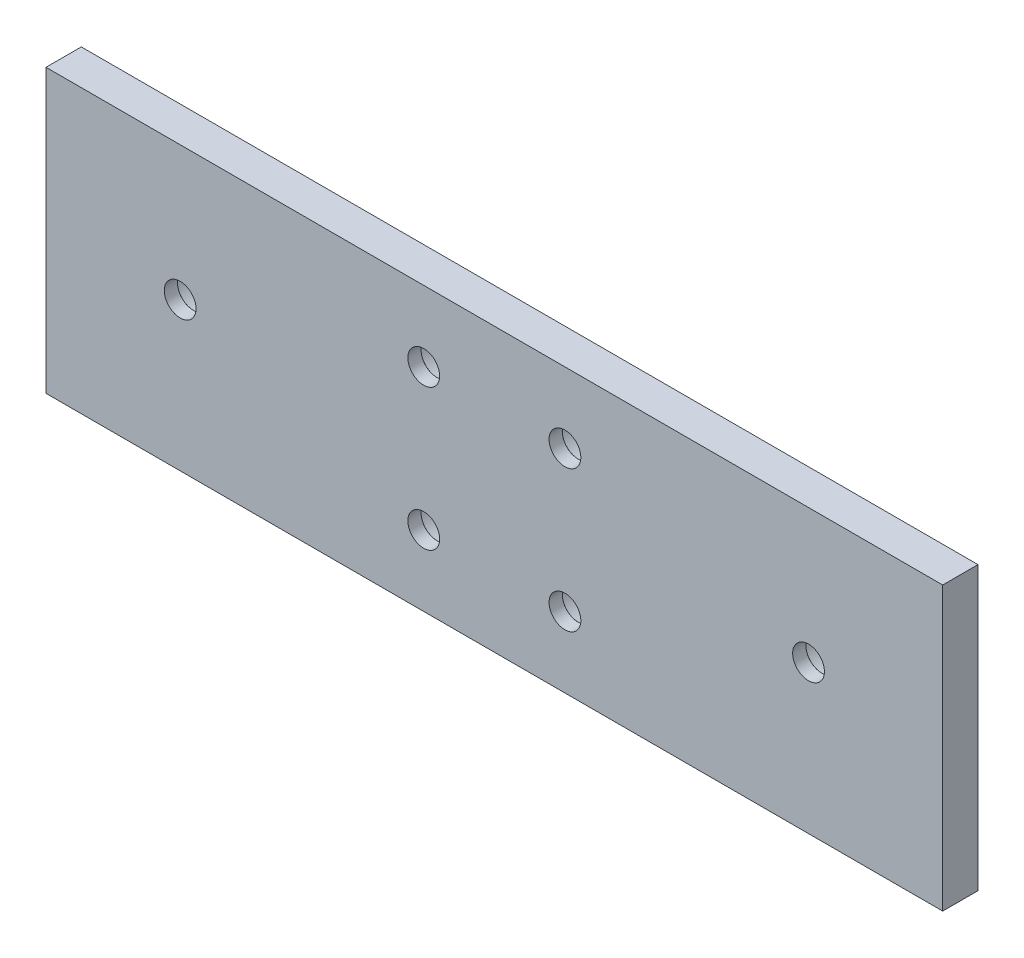
from build123d import *

# Parameters (mm, degrees)
ESQUISSE1_W                                  = 127
ESQUISSE1_H                                  = 40
BOSS_EXTRU_1_DEPTH                           = 5
CHAMBRAGE_POUR_VIS_T_TE_RONDE_BOMB_2_COUNT   = 2
CHAMBRAGE_POUR_VIS_T_TE_RONDE_BOMB_2_PITCH   = 89
D_GAGEMENT_M21_D                             = 2.4
CHAMBRAGE_POUR_VIS_T_TE_RONDE_BOMB_3_A_COUNT = 2
CHAMBRAGE_POUR_VIS_T_TE_RONDE_BOMB_3_A_PITCH = 20
CHAMBRAGE_POUR_VIS_T_TE_RONDE_BOMB_4_COUNT   = 2
CHAMBRAGE_POUR_VIS_T_TE_RONDE_BOMB_4_PITCH   = 20
CHAMBRAGE_POUR_VIS_T_TE_RONDE_BOMB_5_COUNT   = 2
CHAMBRAGE_POUR_VIS_T_TE_RONDE_BOMB_5_PITCH   = 28.284271247


with BuildPart() as part:
    # Esquisse1 → Boss.-Extru.1 (new body)
    with BuildSketch(Plane.XY):
        Rectangle(ESQUISSE1_W, ESQUISSE1_H)
    extrude(amount=BOSS_EXTRU_1_DEPTH)

    # Esquisse2 → Chambrage pour vis _ t_te ronde bomb_e M (revolve, cut)
    with BuildSketch(Plane(origin=(44.5, 1, 0), x_dir=(0, 1, 0), z_dir=(1, 0, 0))):
        Polygon((0, 0), (0, 5), (2.25, 5), (2.25, 3.125), (2.275, 3.1), (4.5, 3.1), (4.5, 0), align=None)
    chambrage_pour_vis_t_te_ronde_bomb_e_m = revolve(axis=Axis((44.5, 1, -6.35), (0, 0, 1)), mode=Mode.SUBTRACT)

    # Chambrage pour vis _ t_te ronde bomb 2: Chambrage pour vis _ t_te ronde bomb_e M ×2
    with Locations(*[(-i * CHAMBRAGE_POUR_VIS_T_TE_RONDE_BOMB_2_PITCH, 0, 0) for i in range(1, CHAMBRAGE_POUR_VIS_T_TE_RONDE_BOMB_2_COUNT)]):
        add(chambrage_pour_vis_t_te_ronde_bomb_e_m, mode=Mode.SUBTRACT)

    # Dégagement M21 (through all)
    with Locations(Plane.XY.offset(5)):
        with Locations((10, -10), (10, 10), (-10, -10), (-10, 10)):
            Hole(D_GAGEMENT_M21_D / 2)

    # Esquisse6 → Chambrage pour vis _ t_te ronde bomb 3 (revolve, cut)
    with BuildSketch(Plane(origin=(10, -10, 0), x_dir=(0, 1, 0), z_dir=(1, 0, 0))):
        Polygon((0, 0), (0, 5), (2.25, 5), (2.25, 3.125), (2.275, 3.1), (4.5, 3.1), (4.5, 0), align=None)
    chambrage_pour_vis_t_te_ronde_bomb_3 = revolve(axis=Axis((10, -10, -6.35), (0, 0, 1)), mode=Mode.SUBTRACT)

    # Chambrage pour vis _ t_te ronde bomb 3 a: Chambrage pour vis _ t_te ronde bomb 3 ×2
    with Locations(*[(0, i * CHAMBRAGE_POUR_VIS_T_TE_RONDE_BOMB_3_A_PITCH, 0) for i in range(1, CHAMBRAGE_POUR_VIS_T_TE_RONDE_BOMB_3_A_COUNT)]):
        add(chambrage_pour_vis_t_te_ronde_bomb_3, mode=Mode.SUBTRACT)

    # Chambrage pour vis _ t_te ronde bomb 4: Chambrage pour vis _ t_te ronde bomb 3 ×2
    with Locations(*[(-i * CHAMBRAGE_POUR_VIS_T_TE_RONDE_BOMB_4_PITCH, 0, 0) for i in range(1, CHAMBRAGE_POUR_VIS_T_TE_RONDE_BOMB_4_COUNT)]):
        add(chambrage_pour_vis_t_te_ronde_bomb_3, mode=Mode.SUBTRACT)

    # Chambrage pour vis _ t_te ronde bomb 5: Chambrage pour vis _ t_te ronde bomb 3 ×2
    with Locations(*[Vector(-0.7071067811865411, 0.707106781186554, 0) * (i * CHAMBRAGE_POUR_VIS_T_TE_RONDE_BOMB_5_PITCH) for i in range(1, CHAMBRAGE_POUR_VIS_T_TE_RONDE_BOMB_5_COUNT)]):
        add(chambrage_pour_vis_t_te_ronde_bomb_3, mode=Mode.SUBTRACT)


solid = part.part
